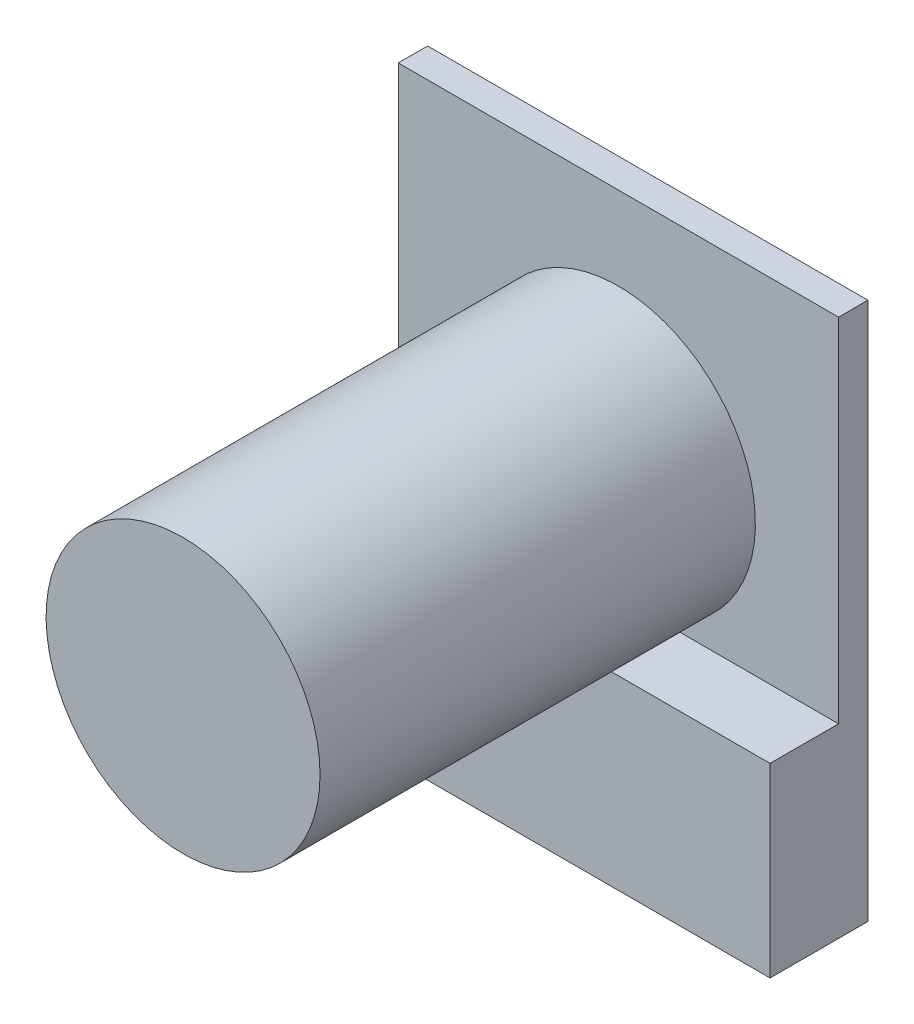
from build123d import *

# Parameters (mm, degrees)
SKETCH_1_W      = 90
SKETCH_1_H      = 90
EXTRUDE_1_DEPTH = 6
SKETCH_2_R      = 28
EXTRUDE_2_DEPTH = 95
SKETCH_3_W      = 90
SKETCH_3_H      = 38
EXTRUDE_3_DEPTH = 20


with BuildPart() as part:
    # 草图1 → 凸台-拉伸1 (new body)
    with BuildSketch(Plane.XY):
        Rectangle(SKETCH_1_W, SKETCH_1_H)
    extrude(amount=EXTRUDE_1_DEPTH)

    # 草图2 → 凸台-拉伸2 (add)
    with BuildSketch(Plane.XY):
        Circle(SKETCH_2_R)
    extrude(amount=EXTRUDE_2_DEPTH)

    # 草图3 → 凸台-拉伸3 (add)
    with BuildSketch(Plane.XY):
        with Locations((0, -46)):
            Rectangle(SKETCH_3_W, SKETCH_3_H)
    extrude(amount=EXTRUDE_3_DEPTH)


solid = part.part
